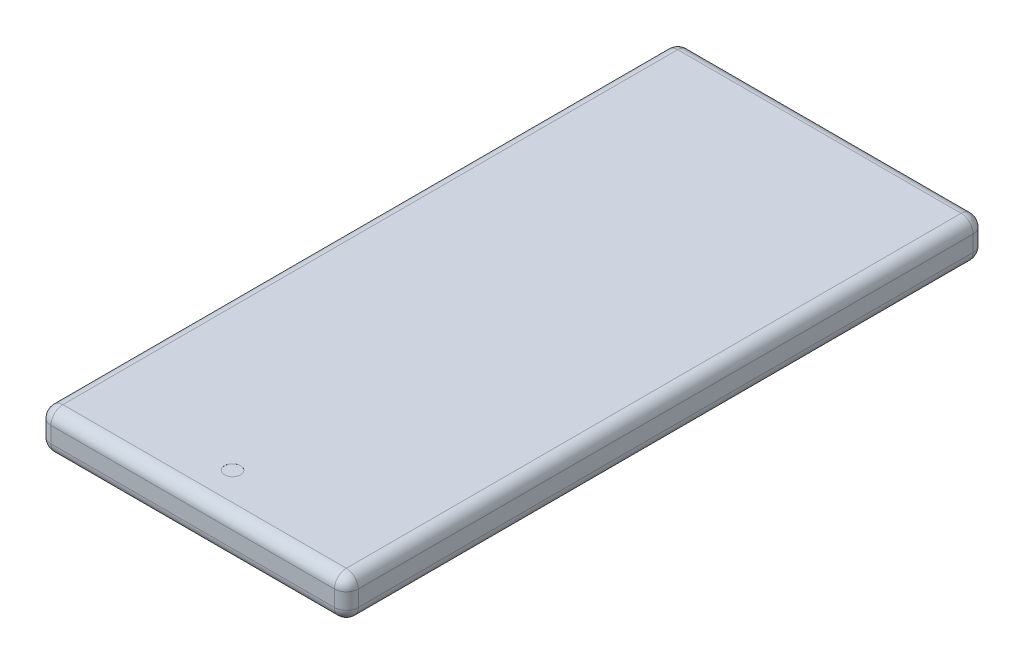
from build123d import *

# Parameters (mm, degrees)
SKETCH1_W           = 77
SKETCH1_H           = 160
BOSS_EXTRUDE1_DEPTH = 10
FILLET1_R           = 3
SKETCH2_R           = 2
CUT_EXTRUDE1_DEPTH  = 0.01
BOSS_EXTRUDE2_DEPTH = 2
FILLET2_R           = 1
SKETCH4_R           = 5.25
SKETCH4_R_2         = 3.5
CUT_EXTRUDE2_DEPTH  = 1
SKETCH5_R           = 2
CUT_EXTRUDE3_DEPTH  = 0.01


with BuildPart() as part:
    # Sketch1 → Boss-Extrude1 (new body)
    with BuildSketch(Plane(origin=(0, 0, 0), x_dir=(1, 0, 0), z_dir=(0, 1, 0))):
        Rectangle(SKETCH1_W, SKETCH1_H)
    extrude(amount=BOSS_EXTRUDE1_DEPTH)

    # Fillet1
    fillet1_edges = [part.edges().sort_by_distance(p)[0] for p in [
        (-38.5, 10, 0),
        (0, 10, 80),
        (38.5, 10, 0),
        (0, 0, 80),
        (-38.5, 0, 0),
        (0, 0, -80),
        (38.5, 0, 0),
        (38.5, 5, 80),
        (-38.5, 5, 80),
        (-38.5, 5, -80),
        (38.5, 5, -80),
        (0, 10, -80),
    ]]
    fillet(fillet1_edges, radius=FILLET1_R)

    # Sketch2 → Cut-Extrude1 (cut)
    with BuildSketch(Plane(origin=(0, 10, 0), x_dir=(1, 0, 0), z_dir=(0, 1, 0))):
        with Locations(Location((0, -70, 0), (0, 0, 270))):
            Circle(SKETCH2_R)
    extrude(amount=-CUT_EXTRUDE1_DEPTH, mode=Mode.SUBTRACT)

    # Sketch3 → Boss-Extrude2 (add)
    with BuildSketch(Plane.XZ):
        with BuildLine():
            Line((-28.5, 72), (-10.5, 72))
            ThreePointArc((-10.5, 72), (-7.671572875, 70.828427125), (-6.5, 68))
            Line((-6.5, 68), (-6.5, 34))
            ThreePointArc((-6.5, 34), (-7.671572875, 31.171572875), (-10.5, 30))
            Line((-10.5, 30), (-28.5, 30))
            ThreePointArc((-28.5, 30), (-31.328427125, 31.171572875), (-32.5, 34))
            Line((-32.5, 34), (-32.5, 68))
            ThreePointArc((-32.5, 68), (-31.328427125, 70.828427125), (-28.5, 72))
        make_face()
    extrude(amount=BOSS_EXTRUDE2_DEPTH)

    # Fillet2
    fillet2_edges = [part.edges().sort_by_distance(p)[0] for p in [
        (-31.328427125, 0, 31.171572875),
        (-19.5, 0, 30),
        (-7.671572875, 0, 31.171572875),
        (-6.5, 0, 51),
        (-7.671572875, 0, 70.828427125),
        (-19.5, 0, 72),
        (-31.328427125, 0, 70.828427125),
        (-32.5, 0, 51),
    ]]
    fillet(fillet2_edges, radius=FILLET2_R)

    # Sketch4 → Cut-Extrude2 (cut)
    with BuildSketch(Plane.XZ.offset(2)):
        with Locations(Location((-25.25, 63.5, 0), (0, 0, 270))):
            Circle(SKETCH4_R)
        with Locations(Location((-25.25, 51, 0), (0, 0, 270))):
            Circle(SKETCH4_R)
        with Locations(Location((-25.25, 38.5, 0), (0, 0, 270))):
            Circle(SKETCH4_R)
        with Locations(Location((-12, 57.25, 0), (0, 0, 270))):
            Circle(SKETCH4_R_2)
        with Locations(Location((-12, 44.75, 0), (0, 0, 270))):
            Circle(SKETCH4_R_2)
    extrude(amount=-CUT_EXTRUDE2_DEPTH, mode=Mode.SUBTRACT)

    # Sketch5 → Cut-Extrude3 (cut)
    with BuildSketch(Plane.XZ.offset(1)):
        with Locations(Location((-12, 44.75, 0), (0, 0, 270))):
            Circle(SKETCH5_R)
    extrude(amount=-CUT_EXTRUDE3_DEPTH, mode=Mode.SUBTRACT)


solid = part.part
